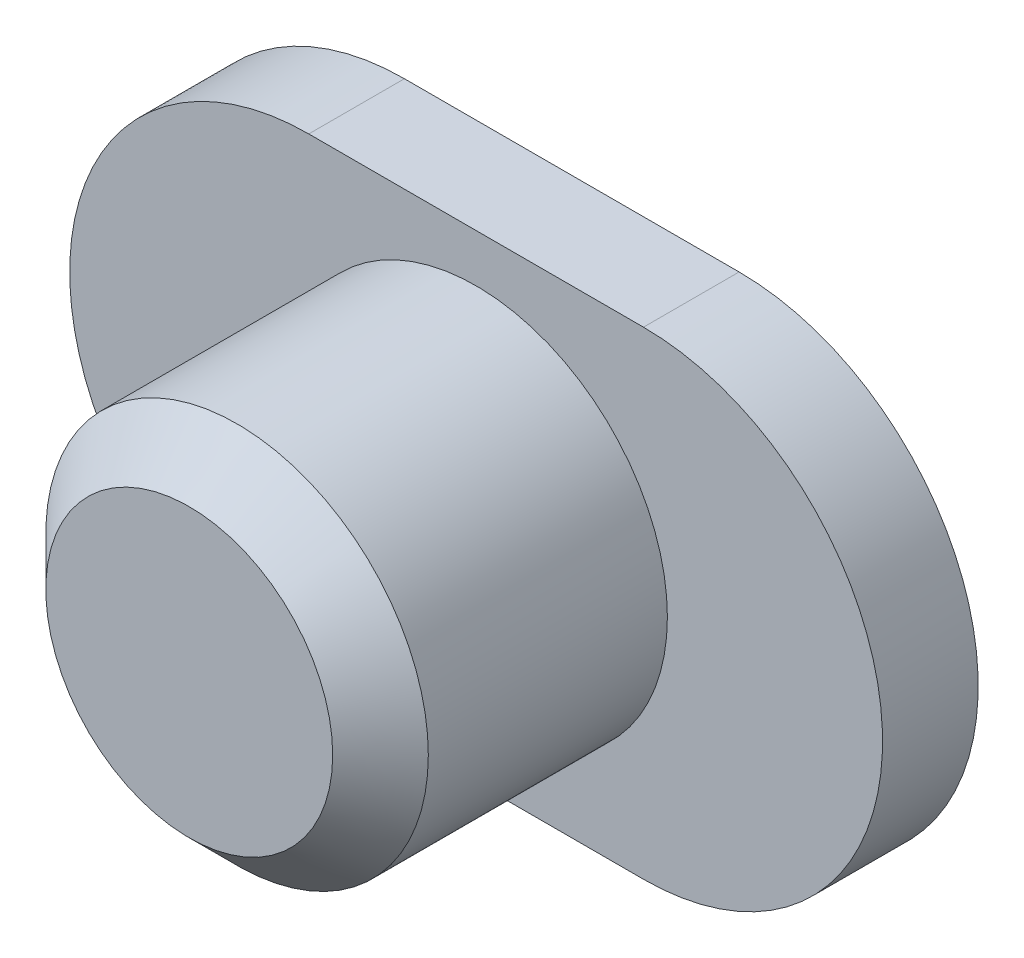
from build123d import *

# Parameters (mm, degrees)
EXTRUDE_1_DEPTH     = 2
SKETCH_2_R          = 4
EXTRUDE_2_DEPTH     = 6
SKETCH_3_R          = 3
CUT_EXTRUDE_1_DEPTH = 4
CHAMFER_1_SIZE      = 1


with BuildPart() as part:
    # Эскиз1 → Бобышка-Вытянуть1 (new body)
    with BuildSketch(Plane.XY):
        with BuildLine():
            Line((-3.5, 5), (3.5, 5))
            ThreePointArc((3.5, 5), (8.5, 0), (3.5, -5))
            Line((3.5, -5), (-3.5, -5))
            ThreePointArc((-3.5, -5), (-8.5, 0), (-3.5, 5))
        make_face()
    extrude(amount=EXTRUDE_1_DEPTH)

    # Эскиз2 → Бобышка-Вытянуть2 (add)
    with BuildSketch(Plane.XY.offset(2)):
        Circle(SKETCH_2_R)
    extrude(amount=EXTRUDE_2_DEPTH)

    # Эскиз3 → Вырез-Вытянуть1 (cut)
    with BuildSketch(Plane(origin=(0, 0, 0), x_dir=(-1, 0, 0), z_dir=(0, 0, -1))):
        Circle(SKETCH_3_R)
    extrude(amount=-CUT_EXTRUDE_1_DEPTH, mode=Mode.SUBTRACT)

    # Фаска1
    chamfer_1_edges = [part.edges().sort_by_distance(p)[0] for p in [
        (-4, 0, 8),
    ]]
    chamfer(chamfer_1_edges, length=CHAMFER_1_SIZE)


solid = part.part
